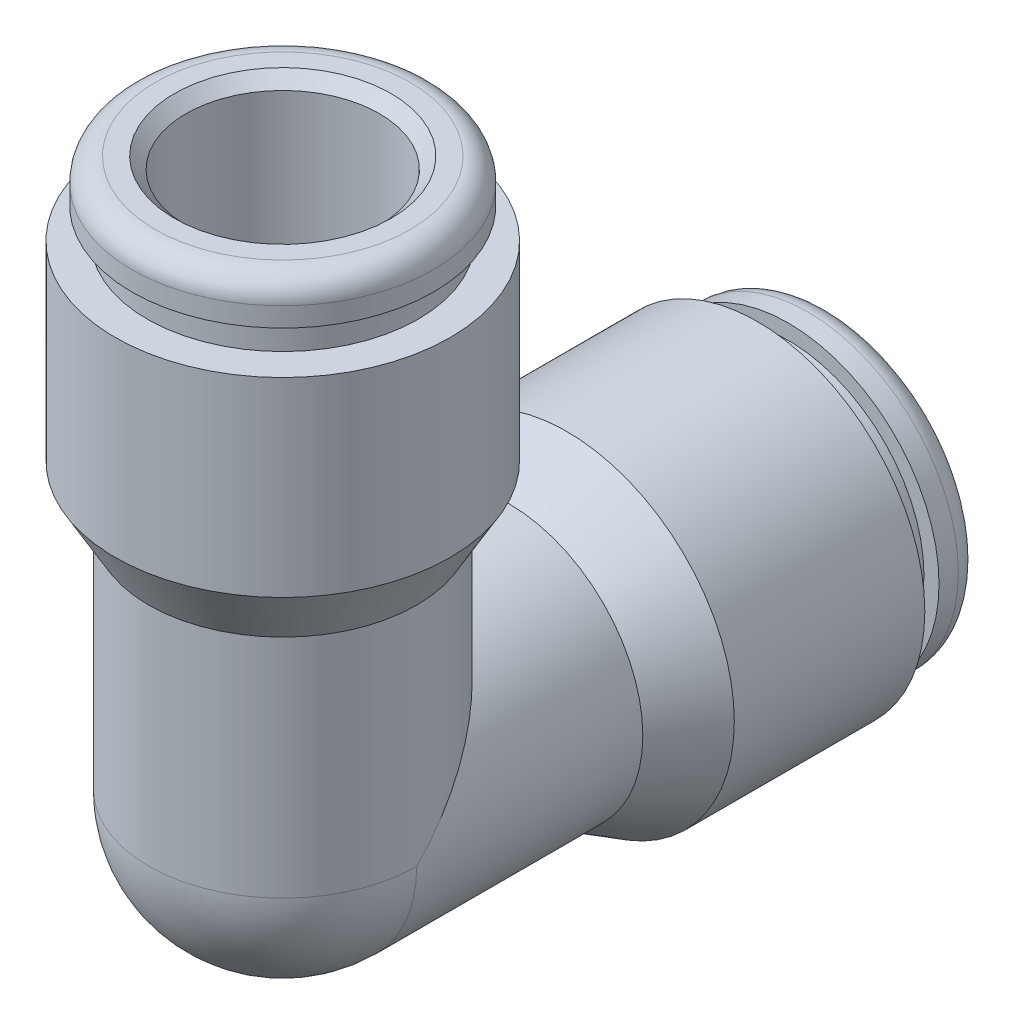
from build123d import *

# Parameters (mm, degrees)
CIRPATTERN1_COUNT = 2
CIRPATTERN1_ANGLE = 90
REVOLVE2_ANGLE    = 90
CIRPATTERN2_COUNT = 2
CIRPATTERN2_ANGLE = 90


with BuildPart() as part:
    # Sketch1 → Revolve1 (revolve)
    with BuildSketch(Plane(origin=(0, 0, 0), x_dir=(0, 0, -1), z_dir=(1, 0, 0)), mode=Mode.PRIVATE) as revolve1_sk:
        with BuildLine():
            Line((16.603, 4.95), (17.238, 4.95))
            ThreePointArc((17.238, 4.95), (17.776815367, 4.726815367), (18, 4.188))
            Line((18, 4.188), (18, 3.556))
            Line((18, 3.556), (17.619, 3.175))
            Line((17.619, 3.175), (3.49914, 3.175))
            Line((3.49914, 3.175), (3.49914, 2.413))
            Line((3.49914, 2.413), (0, 2.413))
            Line((0, 2.413), (0, 4.4))
            Line((0, 4.4), (7.425, 4.4))
            Line((7.425, 4.4), (9.330255888, 5.5))
            Line((9.330255888, 5.5), (15.587, 5.5))
            Line((15.587, 5.5), (15.587, 4.455))
            Line((15.587, 4.455), (16.603, 4.455))
            Line((16.603, 4.455), (16.603, 4.95))
        make_face()
    revolve(revolve1_sk.sketch.rotate(Axis((0, 0, 0), (0, 0, -1)), 90), axis=Axis((0, 0, 0), (0, 0, -1)))


with BuildPart() as cirpattern1_1:
    # CirPattern1: pattern copy
    add(part.part.rotate(Axis((-15.801937006, 0, 0), (1, 0, 0)), 1 * CIRPATTERN1_ANGLE / (CIRPATTERN1_COUNT - 1)))


with BuildPart() as part_1:
    add(part.part)

    # Sketch2 → Revolve2 (revolve)
    with BuildSketch(Plane.XY):
        with BuildLine():
            Line((-4.4, 0), (-2.413, 0))
            ThreePointArc((-2.413, 0), (0, -2.413), (2.413, 0))
            Line((2.413, 0), (4.4, 0))
            ThreePointArc((4.4, 0), (0, -4.4), (-4.4, 0))
        make_face()
    revolve(axis=Axis((-4.4, 0, 0), (-1, 0, 0)), revolution_arc=REVOLVE2_ANGLE)

    # Combine1: union CirPattern1_1
    add(cirpattern1_1.part)

    # Sketch3 → Cut-Revolve1 (revolve, cut)
    with BuildSketch(Plane(origin=(0, 0, 0), x_dir=(0, 0, -1), z_dir=(1, 0, 0)), mode=Mode.PRIVATE) as cut_revolve1_sk:
        Polygon((18, 3.556), (17.619, 3.175), (3.49914, 3.175), (3.49914, 2.413), (0, 2.413), (0, 0), (18, 0), align=None)
    cut_revolve1 = revolve(cut_revolve1_sk.sketch.rotate(Axis((0, 0, 0), (0, 0, -1)), 90), axis=Axis((0, 0, 0), (0, 0, -1)), mode=Mode.SUBTRACT)

    # CirPattern2: Cut-Revolve1 ×2 about axis
    cirpattern2_axis = Axis((-15.801937006, 0, 0), (1, 0, 0))
    for i in range(1, CIRPATTERN2_COUNT):
        add(cut_revolve1.rotate(cirpattern2_axis, i * CIRPATTERN2_ANGLE / (CIRPATTERN2_COUNT - 1)), mode=Mode.SUBTRACT)


solid = part_1.part
